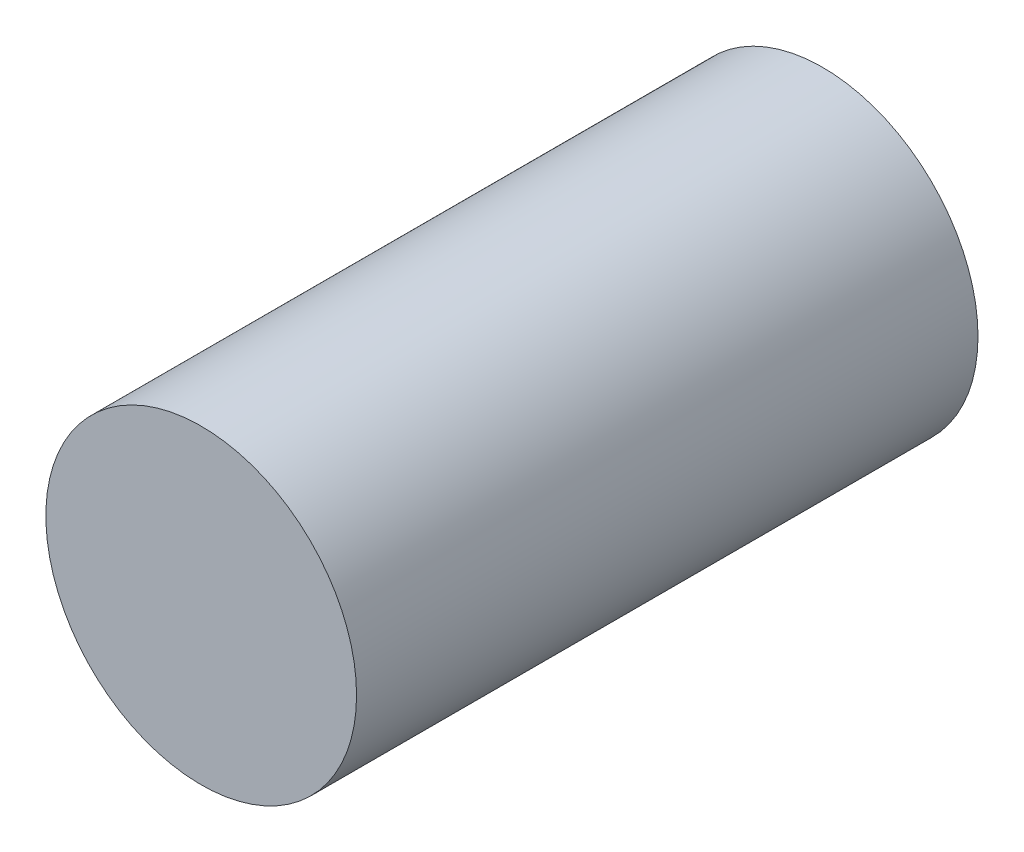
from build123d import *

# Parameters (mm, degrees)
SKETCH1_R           = 7.5
BOSS_EXTRUDE1_DEPTH = 30


with BuildPart() as part:
    # Sketch1 → Boss-Extrude1 (new body)
    with BuildSketch(Plane.XY):
        Circle(SKETCH1_R)
    extrude(amount=-BOSS_EXTRUDE1_DEPTH)


solid = part.part
